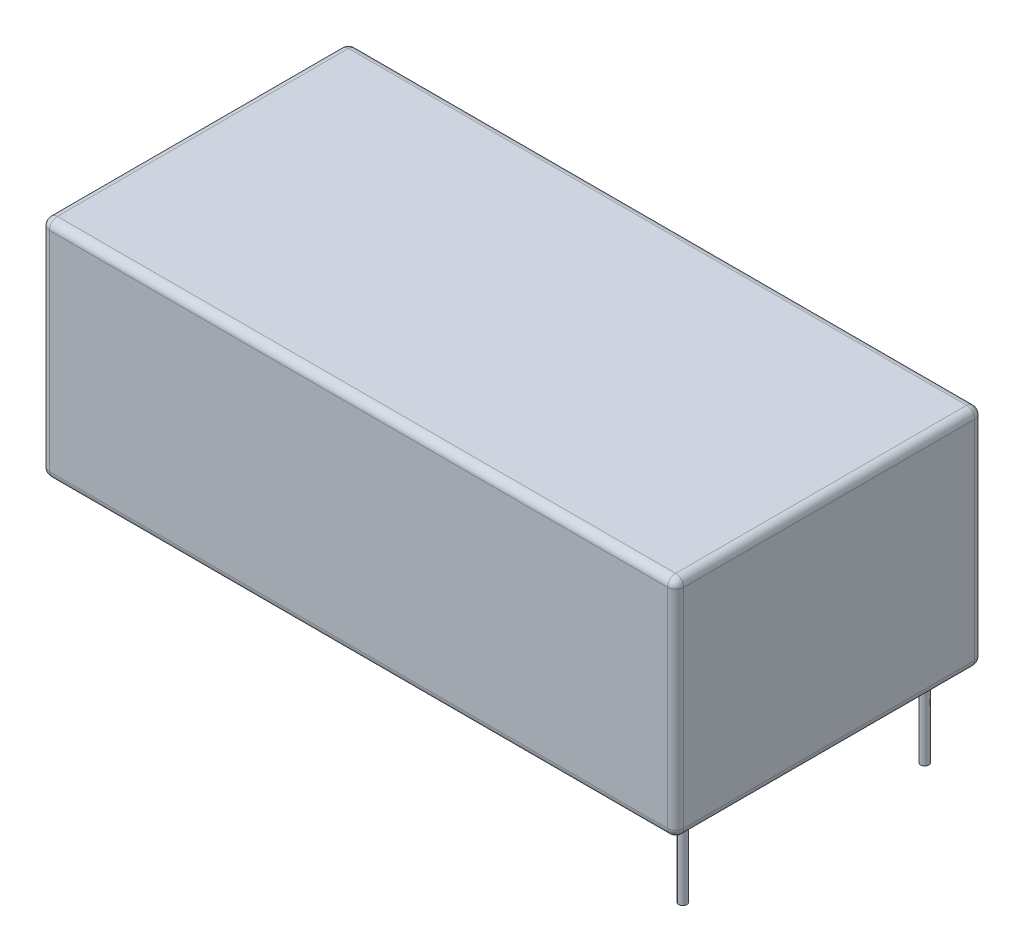
from build123d import *

# Parameters (mm, degrees)
SKETCH1_W           = 78.7
SKETCH1_H           = 27.9
BOSS_EXTRUDE1_DEPTH = 38.1
SKETCH2_R           = 0.5
BOSS_EXTRUDE2_DEPTH = 10
FILLET1_R           = 1


with BuildPart() as part:
    # Sketch1 → Boss-Extrude1 (new body)
    with BuildSketch(Plane.XY):
        with Locations((39.35, 13.95)):
            Rectangle(SKETCH1_W, SKETCH1_H)
    extrude(amount=BOSS_EXTRUDE1_DEPTH)

    # Sketch2 → Boss-Extrude2 (add)
    with BuildSketch(Plane(origin=(0, 0, 0), x_dir=(-1, 0, 0), z_dir=(0, -1, 0))):
        with Locations(Location((-3.2, -4.1, 0), (0, 0, 270))):
            Circle(SKETCH2_R)
        with Locations(Location((-75.6, -4.1, 0), (0, 0, 270))):
            Circle(SKETCH2_R)
        with Locations(Location((-75.6, -34.1, 0), (0, 0, 270))):
            Circle(SKETCH2_R)
        with Locations(Location((-3.2, -19.1, 0), (0, 0, 270))):
            Circle(SKETCH2_R)
    extrude(amount=BOSS_EXTRUDE2_DEPTH)

    # Fillet1
    fillet1_edges = [part.edges().sort_by_distance(p)[0] for p in [
        (78.7, 13.95, 38.1),
        (39.35, 27.9, 38.1),
        (0, 13.95, 38.1),
        (39.35, 27.9, 0),
        (78.7, 13.95, 0),
        (39.35, 0, 0),
        (0, 13.95, 0),
        (39.35, 0, 38.1),
        (0, 27.9, 19.05),
        (78.7, 27.9, 19.05),
        (78.7, 0, 19.05),
        (0, 0, 19.05),
    ]]
    fillet(fillet1_edges, radius=FILLET1_R)


solid = part.part
